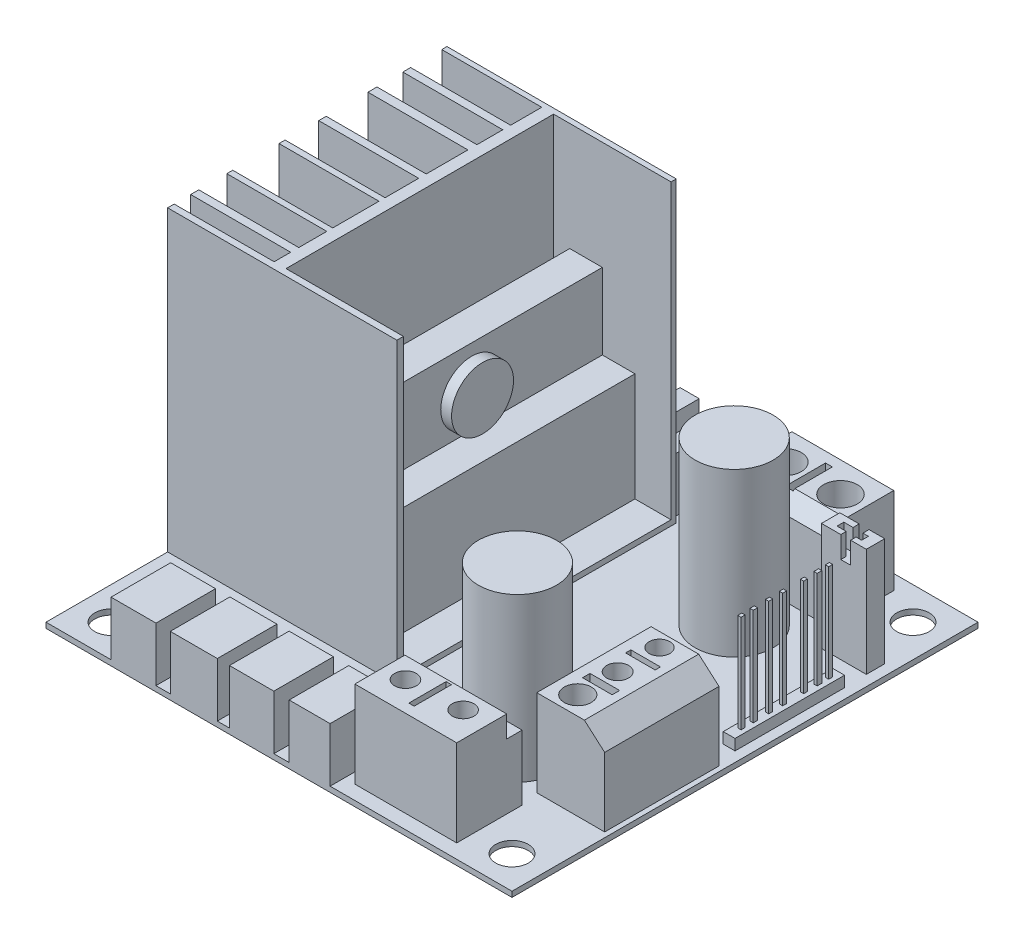
from build123d import *

# Parameters (mm, degrees)
SKETCH_4_W           = 43
SKETCH_4_H           = 43
EXTRUDE_2_DEPTH      = 0.5
SKETCH_5_R           = 1.5
CUT_EXTRUDE_2_DEPTH  = 31.409702399
SKETCH_7_W           = 21.15506674
SKETCH_7_H           = 25.776136706
EXTRUDE_5_DEPTH      = 27.5
SKETCH_8_W           = 20.214087887
SKETCH_8_H           = 5.5
EXTRUDE_8_DEPTH      = 5
SKETCH_9_W           = 20.214087887
SKETCH_9_H           = 5.5
EXTRUDE_9_DEPTH      = 5
SKETCH_13_W          = 9.399431336
SKETCH_13_H          = 6.036332051
EXTRUDE_10_DEPTH     = 8
SKETCH_14_W          = 9.399431336
SKETCH_14_H          = 5.89260986
EXTRUDE_11_DEPTH     = 8
SKETCH_15_R          = 3.6
EXTRUDE_13_DEPTH     = 15
SKETCH_16_R          = 3.6
EXTRUDE_14_DEPTH     = 15
SKETCH_19_W          = 6.266287557
SKETCH_19_H          = 10.54920887
EXTRUDE_15_DEPTH     = 8
SKETCH_20_W          = 4.139199121
SKETCH_20_H          = 1.695921862
EXTRUDE_16_DEPTH     = 10
SKETCH_21_W          = 1.092288657
SKETCH_21_H          = 10.103670076
EXTRUDE_17_DEPTH     = 10
SKETCH_22_W          = 1.322244163
SKETCH_22_H          = 5.5
CUT_EXTRUDE_4_DEPTH  = 5
SKETCH_24_W          = 1.121033095
SKETCH_24_H          = 5.5
CUT_EXTRUDE_5_DEPTH  = 5
SKETCH_26_W          = 1.413554797
SKETCH_26_H          = 5.5
CUT_EXTRUDE_6_DEPTH  = 5
SKETCH_27_R          = 1
SKETCH_27_W          = 0.494239081
SKETCH_27_H          = 3.438597883
CUT_EXTRUDE_8_DEPTH  = 5
SKETCH_29_R          = 1
CUT_EXTRUDE_9_DEPTH  = 5
SKETCH_30_W          = 9.399431336
SKETCH_30_H          = 1.419355379
CUT_EXTRUDE_10_DEPTH = 2
CUT_EXTRUDE_12_DEPTH = 10.55
SKETCH_39_W          = 2.730721642
SKETCH_39_H          = 0.488655451
SKETCH_39_H_2        = 0.68986652
CUT_EXTRUDE_13_DEPTH = 5
SKETCH_40_R          = 0.955583031
SKETCH_40_R_2        = 1.010696692
SKETCH_40_R_3        = 1.245745396
CUT_EXTRUDE_14_DEPTH = 5
SKETCH_42_W          = 9.22612483
SKETCH_42_H          = 2.874443833
SKETCH_42_H_2        = 2.385788382
SKETCH_42_H_3        = 3.851754737
SKETCH_42_H_4        = 3.10439934
SKETCH_42_H_5        = 4.268549093
SKETCH_42_H_6        = 2.58699945
SKETCH_42_H_7        = 1.523455232
CUT_EXTRUDE_15_DEPTH = 27
SKETCH_43_W          = 3.329302409
SKETCH_43_H          = 24.691472532
CUT_EXTRUDE_16_DEPTH = 27
SKETCH_44_W          = 1.48868732
SKETCH_44_H          = 24.691472532
CUT_EXTRUDE_17_DEPTH = 27
SKETCH_45_W          = 6.018064871
SKETCH_45_H          = 24.691472532
CUT_EXTRUDE_18_DEPTH = 10
SKETCH_46_W          = 3.009032436
SKETCH_46_H          = 24.691472532
CUT_EXTRUDE_20_DEPTH = 7
SKETCH_47_R          = 2.856579182
EXTRUDE_18_DEPTH     = 1
SKETCH_48_W          = 2.263895496
SKETCH_48_H          = 0.627342918
CUT_EXTRUDE_21_DEPTH = 2
SKETCH_49_W          = 0.907044807
SKETCH_49_H          = 0.566114145
SKETCH_49_H_2        = 0.502464799
CUT_EXTRUDE_22_DEPTH = 2
SKETCH_51_W          = 0.383059335
SKETCH_51_H          = 10.103670076
SKETCH_51_W_2        = 0.405857085
CUT_EXTRUDE_24_DEPTH = 9
SKETCH_52_W          = 0.303372237
SKETCH_52_H          = 0.691275977
SKETCH_52_H_2        = 0.619026353
SKETCH_52_H_3        = 0.889850382
SKETCH_52_H_4        = 1.563041539
SKETCH_52_H_5        = 0.920801699
SKETCH_52_H_6        = 1.03686914
SKETCH_52_H_7        = 0.750569452
SKETCH_52_H_8        = 0.962684392
CUT_EXTRUDE_25_DEPTH = 9
SKETCH_53_W          = 0.747199288
SKETCH_53_H          = 5.5
SKETCH_53_W_2        = 1.301351305
SKETCH_53_W_3        = 1.130710029
SKETCH_53_W_4        = 1.692627643
SKETCH_53_W_5        = 1.66027218
SKETCH_53_W_6        = 0.72046944
CUT_EXTRUDE_26_DEPTH = 5
SKETCH_54_R          = 1.528058235
SKETCH_54_R_2        = 1.55219967
SKETCH_54_W          = 0.632377644
SKETCH_54_H          = 3.62179923
CUT_EXTRUDE_27_DEPTH = 5
CUT_EXTRUDE_28_DEPTH = 10.376742


with BuildPart() as part:
    # 草图4 → 凸台-拉伸2 (new body)
    with BuildSketch(Plane(origin=(0, 0, 0), x_dir=(1, 0, 0), z_dir=(0, 1, 0))):
        Rectangle(SKETCH_4_W, SKETCH_4_H)
    extrude(amount=EXTRUDE_2_DEPTH)

    # 草图5 → 切除-拉伸2 (cut, through all)
    with BuildSketch(Plane(origin=(0, 0.5, 0), x_dir=(1, 0, 0), z_dir=(0, 1, 0))):
        with Locations(Location((-18.5, 18.5, 0), (0, 0, 270))):
            Circle(SKETCH_5_R)
        with Locations(Location((18.5, 18.5, 0), (0, 0, 270))):
            Circle(SKETCH_5_R)
        with Locations(Location((18.5, -18.5, 0), (0, 0, 270))):
            Circle(SKETCH_5_R)
        with Locations(Location((-18.5, -18.5, 0), (0, 0, 270))):
            Circle(SKETCH_5_R)
    extrude(amount=-CUT_EXTRUDE_2_DEPTH, mode=Mode.SUBTRACT)

    # 草图7 → 凸台-拉伸5 (add)
    with BuildSketch(Plane(origin=(0, 0.5, 0), x_dir=(1, 0, 0), z_dir=(0, 1, 0))):
        with Locations((-10.92246663, 2.611931647)):
            Rectangle(SKETCH_7_W, SKETCH_7_H)
    extrude(amount=EXTRUDE_5_DEPTH)

    # 草图8 → 凸台-拉伸8 (add)
    with BuildSketch(Plane(origin=(0, 0.5, 0), x_dir=(1, 0, 0), z_dir=(0, 1, 0))):
        with Locations((-5.392956057, 18.75)):
            Rectangle(SKETCH_8_W, SKETCH_8_H)
    extrude(amount=EXTRUDE_8_DEPTH)

    # 草图9 → 凸台-拉伸9 (add)
    with BuildSketch(Plane(origin=(0, 0.5, 0), x_dir=(1, 0, 0), z_dir=(0, 1, 0))):
        with Locations((-5.392956057, -18.75)):
            Rectangle(SKETCH_9_W, SKETCH_9_H)
    extrude(amount=EXTRUDE_9_DEPTH)

    # 草图13 → 凸台-拉伸10 (add)
    with BuildSketch(Plane(origin=(0, 0.5, 0), x_dir=(1, 0, 0), z_dir=(0, 1, 0))):
        with Locations((10.391114459, -17.174801907)):
            Rectangle(SKETCH_13_W, SKETCH_13_H)
    extrude(amount=EXTRUDE_10_DEPTH)

    # 草图14 → 凸台-拉伸11 (add)
    with BuildSketch(Plane(origin=(0, 0.5, 0), x_dir=(1, 0, 0), z_dir=(0, 1, 0))):
        with Locations((10.391114459, 17.189174126)):
            Rectangle(SKETCH_14_W, SKETCH_14_H)
    extrude(amount=EXTRUDE_11_DEPTH)

    # 草图15 → 凸台-拉伸13 (add)
    with BuildSketch(Plane(origin=(0, 0.5, 0), x_dir=(1, 0, 0), z_dir=(0, 1, 0))):
        with Locations(Location((10.5, -10, 0), (0, 0, 270))):
            Circle(SKETCH_15_R)
    extrude(amount=EXTRUDE_13_DEPTH)

    # 草图16 → 凸台-拉伸14 (add)
    with BuildSketch(Plane(origin=(0, 0.5, 0), x_dir=(1, 0, 0), z_dir=(0, 1, 0))):
        with Locations(Location((10.5, 10, 0), (0, 0, 270))):
            Circle(SKETCH_16_R)
    extrude(amount=EXTRUDE_14_DEPTH)

    # 草图19 → 凸台-拉伸15 (add)
    with BuildSketch(Plane(origin=(0, 0.5, 0), x_dir=(1, 0, 0), z_dir=(0, 1, 0))):
        with Locations((17.907785085, -7.214854023)):
            Rectangle(SKETCH_19_W, SKETCH_19_H)
    extrude(amount=EXTRUDE_15_DEPTH)

    # 草图20 → 凸台-拉伸16 (add)
    with BuildSketch(Plane(origin=(0, 0.5, 0), x_dir=(1, 0, 0), z_dir=(0, 1, 0))):
        with Locations((18.453929413, 13.021230567)):
            Rectangle(SKETCH_20_W, SKETCH_20_H)
    extrude(amount=EXTRUDE_16_DEPTH)

    # 草图21 → 凸台-拉伸17 (add)
    with BuildSketch(Plane(origin=(0, 0.5, 0), x_dir=(1, 0, 0), z_dir=(0, 1, 0))):
        with Locations((20.034873522, 5.051835038)):
            Rectangle(SKETCH_21_W, SKETCH_21_H)
    extrude(amount=EXTRUDE_17_DEPTH)

    # 草图22 → 切除-拉伸4 (cut)
    with BuildSketch(Plane(origin=(0, 5.5, 0), x_dir=(1, 0, 0), z_dir=(0, 1, 0))):
        with Locations((-10.692931062, -18.75)):
            Rectangle(SKETCH_22_W, SKETCH_22_H)
    extrude(amount=-CUT_EXTRUDE_4_DEPTH, mode=Mode.SUBTRACT)

    # 草图24 → 切除-拉伸5 (cut)
    with BuildSketch(Plane(origin=(0, 5.5, 0), x_dir=(1, 0, 0), z_dir=(0, 1, 0))):
        with Locations((-5.130882244, -18.75)):
            Rectangle(SKETCH_24_W, SKETCH_24_H)
    extrude(amount=-CUT_EXTRUDE_5_DEPTH, mode=Mode.SUBTRACT)

    # 草图26 → 切除-拉伸6 (cut)
    with BuildSketch(Plane(origin=(0, 5.5, 0), x_dir=(1, 0, 0), z_dir=(0, 1, 0))):
        with Locations((0.230347014, -18.75)):
            Rectangle(SKETCH_26_W, SKETCH_26_H)
    extrude(amount=-CUT_EXTRUDE_6_DEPTH, mode=Mode.SUBTRACT)

    # 草图27 → 切除-拉伸8 (cut)
    with BuildSketch(Plane(origin=(0, 8.5, 0), x_dir=(1, 0, 0), z_dir=(0, 1, 0))):
        with Locations(Location((7.676723623, -17.50787521, 0), (0, 0, 270))):
            Circle(SKETCH_27_R)
        with Locations((9.953167513, -17.50787521)):
            Rectangle(SKETCH_27_W, SKETCH_27_H)
    extrude(amount=-CUT_EXTRUDE_8_DEPTH, mode=Mode.SUBTRACT)

    # 草图29 → 切除-拉伸9 (cut)
    with BuildSketch(Plane(origin=(0, 8.5, 0), x_dir=(1, 0, 0), z_dir=(0, 1, 0))):
        with Locations(Location((12.757522449, -17.269272956, 0), (0, 0, 270))):
            Circle(SKETCH_29_R)
    extrude(amount=-CUT_EXTRUDE_9_DEPTH, mode=Mode.SUBTRACT)

    # 草图30 → 切除-拉伸10 (cut)
    with BuildSketch(Plane(origin=(0, 8.5, 0), x_dir=(1, 0, 0), z_dir=(0, 1, 0))):
        with Locations((10.391114459, -14.866313571)):
            Rectangle(SKETCH_30_W, SKETCH_30_H)
    extrude(amount=-CUT_EXTRUDE_10_DEPTH, mode=Mode.SUBTRACT)

    # 草图38 → 切除-拉伸12 (cut)
    with BuildSketch(Plane.XY.offset(12.489458458)):
        Polygon((19.168620675, 8.5), (21.040928863, 6.858966921), (21.040928863, 8.5), align=None)
    extrude(amount=-CUT_EXTRUDE_12_DEPTH, mode=Mode.SUBTRACT)

    # 草图39 → 切除-拉伸13 (cut)
    with BuildSketch(Plane(origin=(0, 8.5, 0), x_dir=(1, 0, 0), z_dir=(0, 1, 0))):
        with Locations((17.059824153, -4.972787832)):
            Rectangle(SKETCH_39_W, SKETCH_39_H)
        with Locations((17.059824153, -8.838914789)):
            Rectangle(SKETCH_39_W, SKETCH_39_H_2)
    extrude(amount=-CUT_EXTRUDE_13_DEPTH, mode=Mode.SUBTRACT)

    # 草图40 → 切除-拉伸14 (cut)
    with BuildSketch(Plane(origin=(0, 8.5, 0), x_dir=(1, 0, 0), z_dir=(0, 1, 0))):
        with Locations(Location((16.834644361, -3.226838398, 0), (0, 0, 270))):
            Circle(SKETCH_40_R)
        with Locations(Location((16.834644361, -7.08556547, 0), (0, 0, 270))):
            Circle(SKETCH_40_R_2)
        with Locations(Location((16.834644361, -10.765517817, 0), (0, 0, 270))):
            Circle(SKETCH_40_R_3)
    extrude(amount=-CUT_EXTRUDE_14_DEPTH, mode=Mode.SUBTRACT)

    # 草图42 → 切除-拉伸15 (cut)
    with BuildSketch(Plane(origin=(0, 28, 0), x_dir=(1, 0, 0), z_dir=(0, 1, 0))):
        with Locations((-16.886937585, 13.581747115)):
            Rectangle(SKETCH_42_W, SKETCH_42_H)
        with Locations((-16.886937585, 10.233020048)):
            Rectangle(SKETCH_42_W, SKETCH_42_H_2)
        with Locations((-16.886937585, 6.280659777)):
            Rectangle(SKETCH_42_W, SKETCH_42_H_3)
        with Locations((-16.886937585, 2.112716218)):
            Rectangle(SKETCH_42_W, SKETCH_42_H_4)
        with Locations((-16.886937585, -2.134274546)):
            Rectangle(SKETCH_42_W, SKETCH_42_H_5)
        with Locations((-16.886937585, -6.108193147)):
            Rectangle(SKETCH_42_W, SKETCH_42_H_6)
        with Locations((-16.886937585, -8.910775885)):
            Rectangle(SKETCH_42_W, SKETCH_42_H_7)
    extrude(amount=-CUT_EXTRUDE_15_DEPTH, mode=Mode.SUBTRACT)

    # 草图43 → 切除-拉伸16 (cut)
    with BuildSketch(Plane(origin=(0, 28, 0), x_dir=(1, 0, 0), z_dir=(0, 1, 0))):
        with Locations((-2.009584465, 2.673232765)):
            Rectangle(SKETCH_43_W, SKETCH_43_H)
    extrude(amount=-CUT_EXTRUDE_16_DEPTH, mode=Mode.SUBTRACT)

    # 草图44 → 切除-拉伸17 (cut)
    with BuildSketch(Plane(origin=(0, 28, 0), x_dir=(1, 0, 0), z_dir=(0, 1, 0))):
        with Locations((-10.4366442, 2.673232765)):
            Rectangle(SKETCH_44_W, SKETCH_44_H)
    extrude(amount=-CUT_EXTRUDE_17_DEPTH, mode=Mode.SUBTRACT)

    # 草图45 → 切除-拉伸18 (cut)
    with BuildSketch(Plane(origin=(0, 28, 0), x_dir=(1, 0, 0), z_dir=(0, 1, 0))):
        with Locations((-6.683268104, 2.673232765)):
            Rectangle(SKETCH_45_W, SKETCH_45_H)
    extrude(amount=-CUT_EXTRUDE_18_DEPTH, mode=Mode.SUBTRACT)

    # 草图46 → 切除-拉伸20 (cut)
    with BuildSketch(Plane(origin=(0, 18, 0), x_dir=(1, 0, 0), z_dir=(0, 1, 0))):
        with Locations((-5.178751887, 2.673232765)):
            Rectangle(SKETCH_46_W, SKETCH_46_H)
    extrude(amount=-CUT_EXTRUDE_20_DEPTH, mode=Mode.SUBTRACT)

    # 草图47 → 凸台-拉伸18 (add)
    with BuildSketch(Plane(origin=(-6.683268105, 0, 0), x_dir=(0, 0, -1), z_dir=(1, 0, 0))):
        with Locations(Location((2.964231218, 14.072605198, 0), (0, 0, 180))):
            Circle(SKETCH_47_R)
    extrude(amount=EXTRUDE_18_DEPTH)

    # 草图48 → 切除-拉伸21 (cut)
    with BuildSketch(Plane(origin=(0, 10.5, 0), x_dir=(1, 0, 0), z_dir=(0, 1, 0))):
        with Locations((18.450273165, 12.989405894)):
            Rectangle(SKETCH_48_W, SKETCH_48_H)
    extrude(amount=-CUT_EXTRUDE_21_DEPTH, mode=Mode.SUBTRACT)

    # 草图49 → 切除-拉伸22 (cut)
    with BuildSketch(Plane(origin=(0, 10.5, 0), x_dir=(1, 0, 0), z_dir=(0, 1, 0))):
        with Locations((18.619504105, 13.586134426)):
            Rectangle(SKETCH_49_W, SKETCH_49_H)
        with Locations((18.619504105, 12.424502036)):
            Rectangle(SKETCH_49_W, SKETCH_49_H_2)
    extrude(amount=-CUT_EXTRUDE_22_DEPTH, mode=Mode.SUBTRACT)

    # 草图51 → 切除-拉伸24 (cut)
    with BuildSketch(Plane(origin=(0, 10.5, 0), x_dir=(1, 0, 0), z_dir=(0, 1, 0))):
        with Locations((19.680258861, 5.051835038)):
            Rectangle(SKETCH_51_W, SKETCH_51_H)
        with Locations((20.378089308, 5.051835038)):
            Rectangle(SKETCH_51_W_2, SKETCH_51_H)
    extrude(amount=-CUT_EXTRUDE_24_DEPTH, mode=Mode.SUBTRACT)

    # 草图52 → 切除-拉伸25 (cut)
    with BuildSketch(Plane(origin=(0, 10.5, 0), x_dir=(1, 0, 0), z_dir=(0, 1, 0))):
        with Locations((20.023474646, 9.758032088)):
            Rectangle(SKETCH_52_W, SKETCH_52_H)
        with Locations((20.023474646, 8.731465112)):
            Rectangle(SKETCH_52_W, SKETCH_52_H_2)
        with Locations((20.023474646, 7.535970469)):
            Rectangle(SKETCH_52_W, SKETCH_52_H_3)
        with Locations((20.023474646, 5.953584357)):
            Rectangle(SKETCH_52_W, SKETCH_52_H_4)
        with Locations((20.023474646, 4.340246926)):
            Rectangle(SKETCH_52_W, SKETCH_52_H_5)
        with Locations((20.023474646, 2.997733525)):
            Rectangle(SKETCH_52_W, SKETCH_52_H_6)
        with Locations((20.023474646, 1.709384929)):
            Rectangle(SKETCH_52_W, SKETCH_52_H_7)
        with Locations((20.023474646, 0.481342196)):
            Rectangle(SKETCH_52_W, SKETCH_52_H_8)
    extrude(amount=-CUT_EXTRUDE_25_DEPTH, mode=Mode.SUBTRACT)

    # 草图53 → 切除-拉伸26 (cut)
    with BuildSketch(Plane(origin=(0, 5.5, 0), x_dir=(1, 0, 0), z_dir=(0, 1, 0))):
        with Locations((-12.850447994, 18.75)):
            Rectangle(SKETCH_53_W, SKETCH_53_H)
        with Locations((-9.96643689, 18.75)):
            Rectangle(SKETCH_53_W_2, SKETCH_53_H)
        with Locations((-6.554914677, 18.75)):
            Rectangle(SKETCH_53_W_3, SKETCH_53_H)
        with Locations((-3.37719278, 18.75)):
            Rectangle(SKETCH_53_W_4, SKETCH_53_H)
        with Locations((-0.084711216, 18.75)):
            Rectangle(SKETCH_53_W_5, SKETCH_53_H)
        with Locations((2.628365945, 18.75)):
            Rectangle(SKETCH_53_W_6, SKETCH_53_H)
    extrude(amount=-CUT_EXTRUDE_26_DEPTH, mode=Mode.SUBTRACT)

    # 草图54 → 切除-拉伸27 (cut)
    with BuildSketch(Plane(origin=(0, 8.5, 0), x_dir=(1, 0, 0), z_dir=(0, 1, 0))):
        with Locations(Location((7.78974279, 17.376012975, 0), (0, 0, 270))):
            Circle(SKETCH_54_R)
        with Locations(Location((12.934997252, 17.376012975, 0), (0, 0, 270))):
            Circle(SKETCH_54_R_2)
        with Locations((10.060553418, 17.376012975)):
            Rectangle(SKETCH_54_W, SKETCH_54_H)
    extrude(amount=-CUT_EXTRUDE_27_DEPTH, mode=Mode.SUBTRACT)

    # 草图55 → 切除-拉伸28 (cut)
    with BuildSketch(Plane(origin=(15.090830127, 0, 0), x_dir=(0, 0, -1), z_dir=(1, 0, 0))):
        Polygon((15.724283744, 8.5), (14.242869196, 7.459716665), (14.242869196, 8.5), align=None)
    extrude(amount=-CUT_EXTRUDE_28_DEPTH, mode=Mode.SUBTRACT)


solid = part.part
